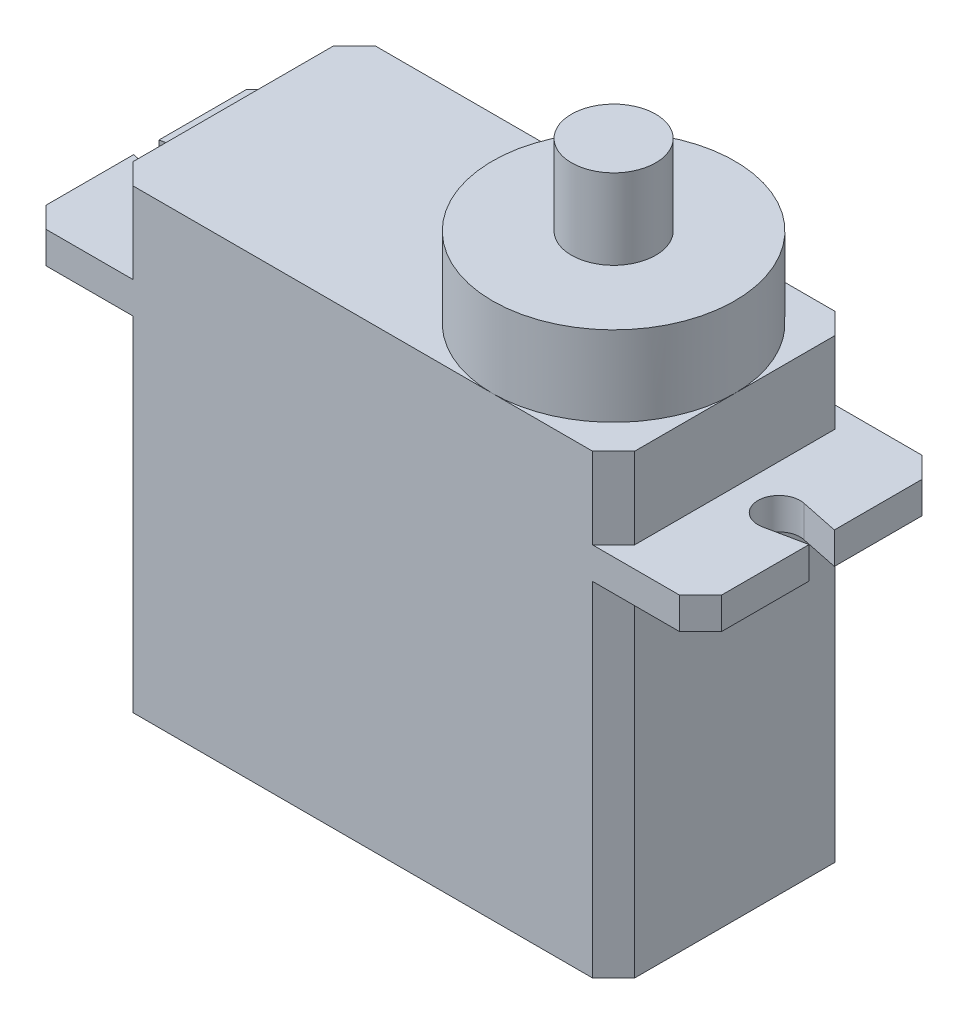
from build123d import *

# Parameters (mm, degrees)
BOSS_EXTRUDE1_DEPTH = 21.65
SKETCH1_3_R         = 5.75
BOSS_EXTRUDE2_DEPTH = 25.45
SKETCH1_4_R         = 2
BOSS_EXTRUDE3_DEPTH = 29.25
BOSS_EXTRUDE4_START = 16.3
BOSS_EXTRUDE4_DEPTH = 1.5


with BuildPart() as part:
    # Sketch1 → Boss-Extrude1 (new body)
    with BuildSketch(Plane(origin=(0, 0, 0), x_dir=(1, 0, 0), z_dir=(0, 1, 0))):
        Polygon((-10.9, -5.75), (10.9, -5.75), (11.9, -4.75), (11.9, 4.75), (10.9, 5.75), (-10.9, 5.75), (-11.9, 4.75), (-11.9, -4.75), align=None)
    extrude(amount=BOSS_EXTRUDE1_DEPTH)

    # Sketch1<3> → Boss-Extrude2 (add)
    with BuildSketch(Plane(origin=(0, 0, 0), x_dir=(1, 0, 0), z_dir=(0, 1, 0))):
        with Locations((6.15, 0)):
            Circle(SKETCH1_3_R)
    extrude(amount=BOSS_EXTRUDE2_DEPTH)

    # Sketch1<4> → Boss-Extrude3 (add)
    with BuildSketch(Plane(origin=(0, 0, 0), x_dir=(1, 0, 0), z_dir=(0, 1, 0))):
        with Locations((6.15, 0)):
            Circle(SKETCH1_4_R)
    extrude(amount=BOSS_EXTRUDE3_DEPTH)

    # Sketch1<5> → Boss-Extrude4 (add)
    with BuildSketch(Plane(origin=(0, 0, 0), x_dir=(1, 0, 0), z_dir=(0, 1, 0)).offset(BOSS_EXTRUDE4_START)):
        with BuildLine():
            Line((-15.025, -5.75), (-10.9, -5.75))
            Line((-10.9, -5.75), (-11.9, -4.75))
            Line((-11.9, -4.75), (-11.9, 4.75))
            Line((-11.9, 4.75), (-10.9, 5.75))
            Line((-10.9, 5.75), (-15.025, 5.75))
            Line((-15.025, 5.75), (-16.025, 4.75))
            Line((-16.025, 4.75), (-16.025, 0.6))
            Line((-16.025, 0.6), (-14.203746042, 0.979023774))
            ThreePointArc((-14.203746042, 0.979023774), (-13, 0), (-14.203746042, -0.979023774))
            Line((-14.203746042, -0.979023774), (-16.025, -0.6))
            Line((-16.025, -0.6), (-16.025, -4.75))
            Line((-16.025, -4.75), (-15.025, -5.75))
        make_face()
        with BuildLine():
            Line((11.9, -4.75), (10.9, -5.75))
            Line((10.9, -5.75), (15.025, -5.75))
            Line((15.025, -5.75), (16.025, -4.75))
            Line((16.025, -4.75), (16.025, -0.6))
            Line((16.025, -0.6), (14.203746042, -0.979023774))
            ThreePointArc((14.203746042, -0.979023774), (13, 0), (14.203746042, 0.979023774))
            Line((14.203746042, 0.979023774), (16.025, 0.6))
            Line((16.025, 0.6), (16.025, 4.75))
            Line((16.025, 4.75), (15.025, 5.75))
            Line((15.025, 5.75), (10.9, 5.75))
            Line((10.9, 5.75), (11.9, 4.75))
            Line((11.9, 4.75), (11.9, -4.75))
        make_face()
    extrude(amount=BOSS_EXTRUDE4_DEPTH)


solid = part.part
